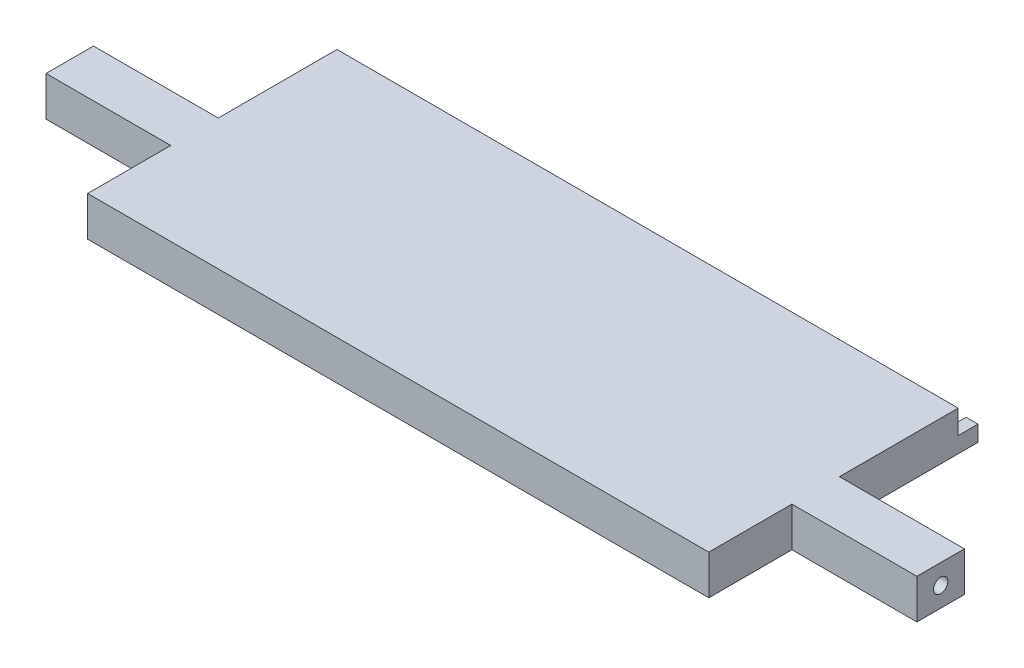
from build123d import *

# Parameters (mm, degrees)
SKETCH_1_W          = 220
SKETCH_1_H          = 10
SKETCH_1_R          = 3.6
EXTRUDE_1_DEPTH     = 65
SKETCH_2_W          = 220
SKETCH_2_H          = 5
CUT_EXTRUDE_1_DEPTH = 6
SKETCH_3_W          = 31.511676707
SKETCH_3_H          = 35
SKETCH_3_H_2        = 18
SKETCH_3_W_2        = 31.571676707
CUT_EXTRUDE_2_DEPTH = 230.619250064
SKETCH_4_R          = 1.8
CUT_EXTRUDE_3_DEPTH = 10
CUT_EXTRUDE_START   = -10
SKETCH_5_R          = 1.8
CUT_EXTRUDE_4_DEPTH = 10
SKETCH_6_W          = 156.916646586
SKETCH_6_H          = 10
EXTRUDE_2_DEPTH     = 3


with BuildPart() as part:
    # Эскиз1 → Бобышка-Вытянуть1 (new body)
    with BuildSketch(Plane.XY):
        with Locations((110, 5)):
            Rectangle(SKETCH_1_W, SKETCH_1_H)
        with Locations((37.97, 5)):
            Circle(SKETCH_1_R, mode=Mode.SUBTRACT)
        with Locations((55.97, 5)):
            Circle(SKETCH_1_R, mode=Mode.SUBTRACT)
        with Locations((73.97, 5)):
            Circle(SKETCH_1_R, mode=Mode.SUBTRACT)
        with Locations((91.97, 5)):
            Circle(SKETCH_1_R, mode=Mode.SUBTRACT)
        with Locations((109.97, 5)):
            Circle(SKETCH_1_R, mode=Mode.SUBTRACT)
        with Locations((127.97, 5)):
            Circle(SKETCH_1_R, mode=Mode.SUBTRACT)
        with Locations((145.97, 5)):
            Circle(SKETCH_1_R, mode=Mode.SUBTRACT)
        with Locations((163.97, 5)):
            Circle(SKETCH_1_R, mode=Mode.SUBTRACT)
        with Locations((181.97, 5)):
            Circle(SKETCH_1_R, mode=Mode.SUBTRACT)
    extrude(amount=EXTRUDE_1_DEPTH)

    # Эскиз2 → Вырез-Вытянуть1 (cut)
    with BuildSketch(Plane(origin=(0, 10, 0), x_dir=(1, 0, 0), z_dir=(0, 1, 0))):
        with Locations((110, -2.5)):
            Rectangle(SKETCH_2_W, SKETCH_2_H)
    extrude(amount=-CUT_EXTRUDE_1_DEPTH, mode=Mode.SUBTRACT)

    # Эскиз3 → Вырез-Вытянуть2 (cut, through all)
    with BuildSketch(Plane(origin=(0, 10, 0), x_dir=(1, 0, 0), z_dir=(0, 1, 0))):
        with Locations((15.755838354, -17.5)):
            Rectangle(SKETCH_3_W, SKETCH_3_H)
        with Locations((15.755838354, -56)):
            Rectangle(SKETCH_3_W, SKETCH_3_H_2)
        with Locations((204.214161647, -17.5)):
            Rectangle(SKETCH_3_W_2, SKETCH_3_H)
        with Locations((204.214161647, -56)):
            Rectangle(SKETCH_3_W_2, SKETCH_3_H_2)
    extrude(amount=-CUT_EXTRUDE_2_DEPTH, mode=Mode.SUBTRACT)

    # Эскиз4 → Вырез-Вытянуть3 (cut)
    with BuildSketch(Plane.ZY):
        with Locations((41, 5)):
            Circle(SKETCH_4_R)
    extrude(amount=-CUT_EXTRUDE_3_DEPTH, mode=Mode.SUBTRACT)

    # Эскиз5 → Вырез-Вытянуть4 (cut)
    with BuildSketch(Plane(origin=(220, 0, 0), x_dir=(0, 0, -1), z_dir=(1, 0, 0)).offset(CUT_EXTRUDE_START)):
        with Locations(Location((-41, 5, 0), (0, 0, 180))):
            Circle(SKETCH_5_R)
    extrude(amount=CUT_EXTRUDE_4_DEPTH, mode=Mode.SUBTRACT)

    # Эскиз6 → Бобышка-Вытянуть2 (add)
    with BuildSketch(Plane.XY.offset(65)):
        with Locations((109.97, 5)):
            Rectangle(SKETCH_6_W, SKETCH_6_H)
    extrude(amount=EXTRUDE_2_DEPTH)


solid = part.part
